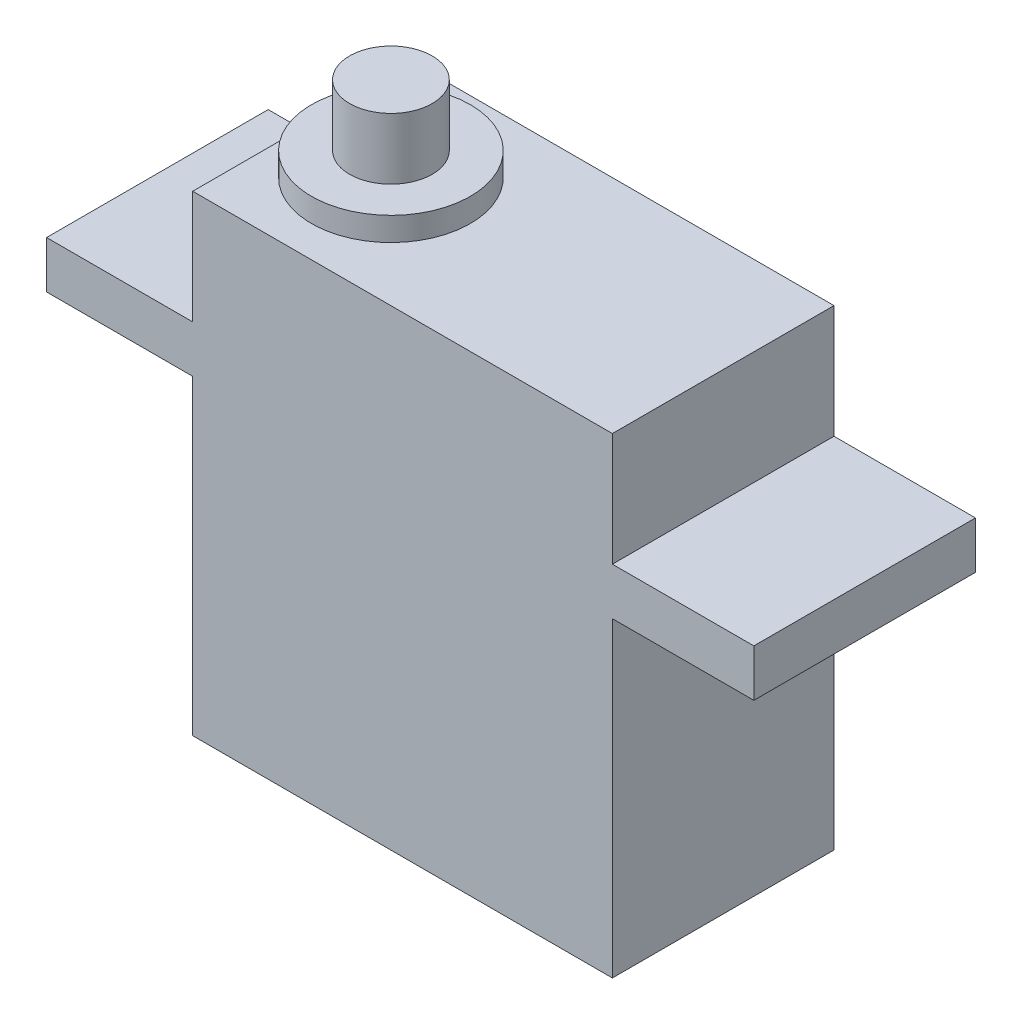
from build123d import *

# Parameters (mm, degrees)
SKETCH1_W                = 22.606
SKETCH1_H                = 11.938
BOSS_EXTRUDE1_DEPTH      = 25.4
SKETCH2_R                = 2.224672202
BOSS_EXTRUDE2_DEPTH      = 4.572
SKETCH3_R                = 4.279679958
BOSS_EXTRUDE3_DEPTH      = 1.27
BOSS_EXTRUDE4_DEPTH      = 7.62
BOSS_EXTRUDE4_DEPTH_BACK = 30.48
SKETCH4_W                = 11.938
SKETCH4_H                = 2.54


with BuildPart() as part:
    # Sketch1 → Boss-Extrude1 (new body)
    with BuildSketch(Plane(origin=(0, 0, 0), x_dir=(1, 0, 0), z_dir=(0, 1, 0))):
        with Locations((11.303, 5.969)):
            Rectangle(SKETCH1_W, SKETCH1_H)
    extrude(amount=BOSS_EXTRUDE1_DEPTH)

    # Sketch2 → Boss-Extrude2 (add)
    with BuildSketch(Plane(origin=(0, 25.4, 0), x_dir=(1, 0, 0), z_dir=(0, 1, 0))):
        with Locations(Location((4.707032939, 5.969, 0), (0, 0, 90))):
            Circle(SKETCH2_R)
    extrude(amount=BOSS_EXTRUDE2_DEPTH)

    # Sketch3 → Boss-Extrude3 (add)
    with BuildSketch(Plane(origin=(0, 25.4, 0), x_dir=(1, 0, 0), z_dir=(0, 1, 0))):
        with Locations(Location((4.707032939, 5.969, 0), (0, 0, 90))):
            Circle(SKETCH3_R)
    extrude(amount=BOSS_EXTRUDE3_DEPTH)

    # Sketch4 → Boss-Extrude4 (add, two sides: drawn at the far end of the back side and taken through both)
    with BuildSketch(Plane(origin=(22.606, 0, 0), x_dir=(0, 0, -1), z_dir=(1, 0, 0)).offset(-BOSS_EXTRUDE4_DEPTH_BACK)):
        with Locations((5.969, 18.034)):
            Rectangle(SKETCH4_W, SKETCH4_H)
    extrude(amount=BOSS_EXTRUDE4_DEPTH + BOSS_EXTRUDE4_DEPTH_BACK)


solid = part.part
